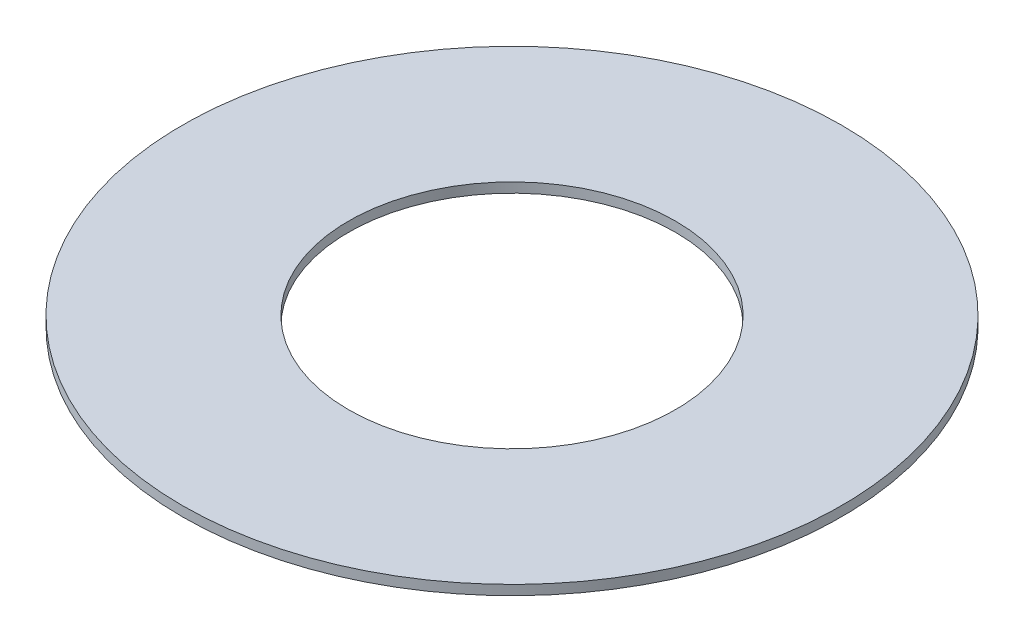
from build123d import *

# Parameters (mm, degrees)
SKETCH1_R           = 67.48
SKETCH1_R_2         = 33.47
BOSS_EXTRUDE1_DEPTH = 2


with BuildPart() as part:
    # Sketch1 → Boss-Extrude1 (new body)
    with BuildSketch(Plane(origin=(0, 0, 0), x_dir=(1, 0, 0), z_dir=(0, 1, 0))):
        with Locations(Location((0, 0, 0), (0, 0, 270))):
            Circle(SKETCH1_R)
        with Locations(Location((0, 0, 0), (0, 0, 270))):
            Circle(SKETCH1_R_2, mode=Mode.SUBTRACT)
    extrude(amount=BOSS_EXTRUDE1_DEPTH)


solid = part.part
